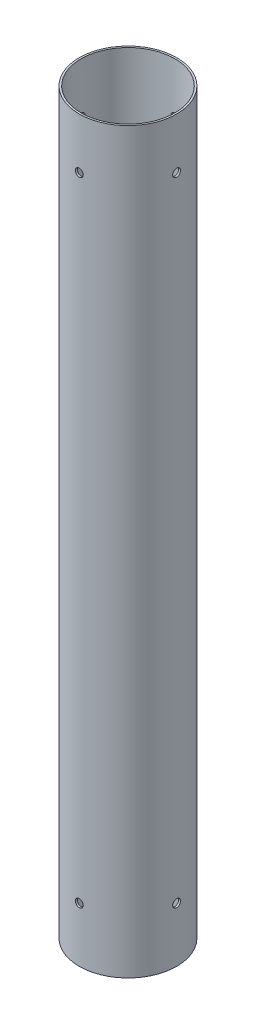
from build123d import *

# Parameters (mm, degrees)
SKETCH4_R           = 39.6
SKETCH4_R_2         = 38.1
BOSS_EXTRUDE2_DEPTH = 599.44
SKETCH5_R           = 3.175
CUT_EXTRUDE1_DEPTH  = 603.050358027
CIRPATTERN1_COUNT   = 4
SKETCH6_R           = 3.175
CUT_EXTRUDE2_DEPTH  = 603.050358139
CIRPATTERN2_COUNT   = 4


with BuildPart() as part:
    # Sketch4 → Boss-Extrude2 (new body)
    with BuildSketch(Plane(origin=(0, 0, 0), x_dir=(1, 0, 0), z_dir=(0, 1, 0))):
        with Locations(Location((0, 0, 0), (0, 0, 270))):
            Circle(SKETCH4_R)
        with Locations(Location((0, 0, 0), (0, 0, 270))):
            Circle(SKETCH4_R_2, mode=Mode.SUBTRACT)
    extrude(amount=BOSS_EXTRUDE2_DEPTH)

    # Sketch5 → Cut-Extrude1 (cut, through all)
    with BuildSketch(Plane(origin=(0, 0, 0), x_dir=(0, 0, -1), z_dir=(1, 0, 0))):
        with Locations((0, 44.45)):
            Circle(SKETCH5_R)
    cut_extrude1 = extrude(amount=-CUT_EXTRUDE1_DEPTH, mode=Mode.SUBTRACT)

    # CirPattern1: Cut-Extrude1 ×4 about axis
    cirpattern1_axis = Axis((0, 599.44, 0), (0, -1, 0))
    for i in range(1, CIRPATTERN1_COUNT):
        add(cut_extrude1.rotate(cirpattern1_axis, i * 360 / CIRPATTERN1_COUNT), mode=Mode.SUBTRACT)

    # Sketch6 → Cut-Extrude2 (cut, through all)
    with BuildSketch(Plane(origin=(0, 0, 0), x_dir=(0, 0, -1), z_dir=(1, 0, 0))):
        with Locations(Location((0, 558.165, 0), (0, 0, 180))):
            Circle(SKETCH6_R)
    cut_extrude2 = extrude(amount=CUT_EXTRUDE2_DEPTH, mode=Mode.SUBTRACT)

    # CirPattern2: Cut-Extrude2 ×4 about axis
    cirpattern2_axis = Axis((0, 599.44, 0), (0, -1, 0))
    for i in range(1, CIRPATTERN2_COUNT):
        add(cut_extrude2.rotate(cirpattern2_axis, i * 360 / CIRPATTERN2_COUNT), mode=Mode.SUBTRACT)


solid = part.part
